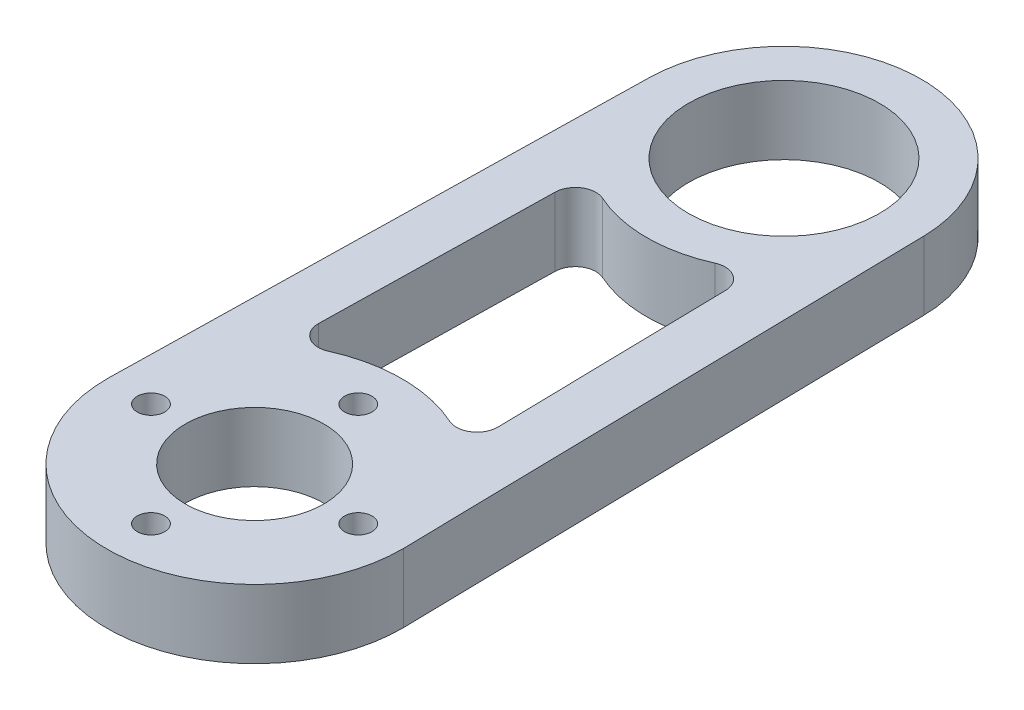
from build123d import *

# Parameters (mm, degrees)
SKETCH1_R           = 13.91353128
SKETCH1_R_2         = 2
SKETCH1_R_3         = 10.1
BOSS_EXTRUDE1_DEPTH = 10


with BuildPart() as part:
    # Sketch1 → Boss-Extrude1 (new body)
    with BuildSketch(Plane(origin=(0, 0, 0), x_dir=(1, 0, 0), z_dir=(0, 1, 0))):
        with BuildLine():
            Line((21.498983302, 0.209086062), (19.99622214, 77.513715994))
            ThreePointArc((19.99622214, 77.513715994), (0, 97.125), (-19.99622214, 77.513715994))
            Line((-19.99622214, 77.513715994), (-21.498983302, 0.209086062))
            ThreePointArc((-21.498983302, 0.209086062), (0, -21.5), (21.498983302, 0.209086062))
        make_face()
        with Locations(Location((0, 77.125, 0), (0, 0, 270))):
            Circle(SKETCH1_R, mode=Mode.SUBTRACT)
        with Locations(Location((0, 15.1, 0), (0, 0, 270))):
            Circle(SKETCH1_R_2, mode=Mode.SUBTRACT)
        with Locations(Location((15.1, 0, 0), (0, 0, 270))):
            Circle(SKETCH1_R_2, mode=Mode.SUBTRACT)
        with Locations(Location((0, -15.1, 0), (0, 0, 90))):
            Circle(SKETCH1_R_2, mode=Mode.SUBTRACT)
        with Locations(Location((0, 0, 0), (0, 0, 270))):
            Circle(SKETCH1_R_3, mode=Mode.SUBTRACT)
        with Locations(Location((-15.1, 0, 0), (0, 0, 90))):
            Circle(SKETCH1_R_2, mode=Mode.SUBTRACT)
        with BuildLine():
            Line((13.06692571, 22.394317415), (12.409386822, 56.196380392))
            ThreePointArc((12.409386822, 56.196380392), (11.016008446, 58.671921864), (8.182568929, 58.875463959))
            ThreePointArc((8.182568929, 58.875463959), (0, 57.125), (-8.182568929, 58.875463959))
            ThreePointArc((-8.182568929, 58.875463959), (-11.016008446, 58.671921864), (-12.409386822, 56.196380392))
            Line((-12.409386822, 56.196380392), (-13.06692571, 22.394317415))
            ThreePointArc((-13.06692571, 22.394317415), (-11.720069374, 19.832175089), (-8.834738892, 19.600953771))
            ThreePointArc((-8.834738892, 19.600953771), (0, 21.5), (8.834738892, 19.600953771))
            ThreePointArc((8.834738892, 19.600953771), (11.720069374, 19.832175089), (13.06692571, 22.394317415))
        make_face(mode=Mode.SUBTRACT)
    extrude(amount=BOSS_EXTRUDE1_DEPTH)


solid = part.part
